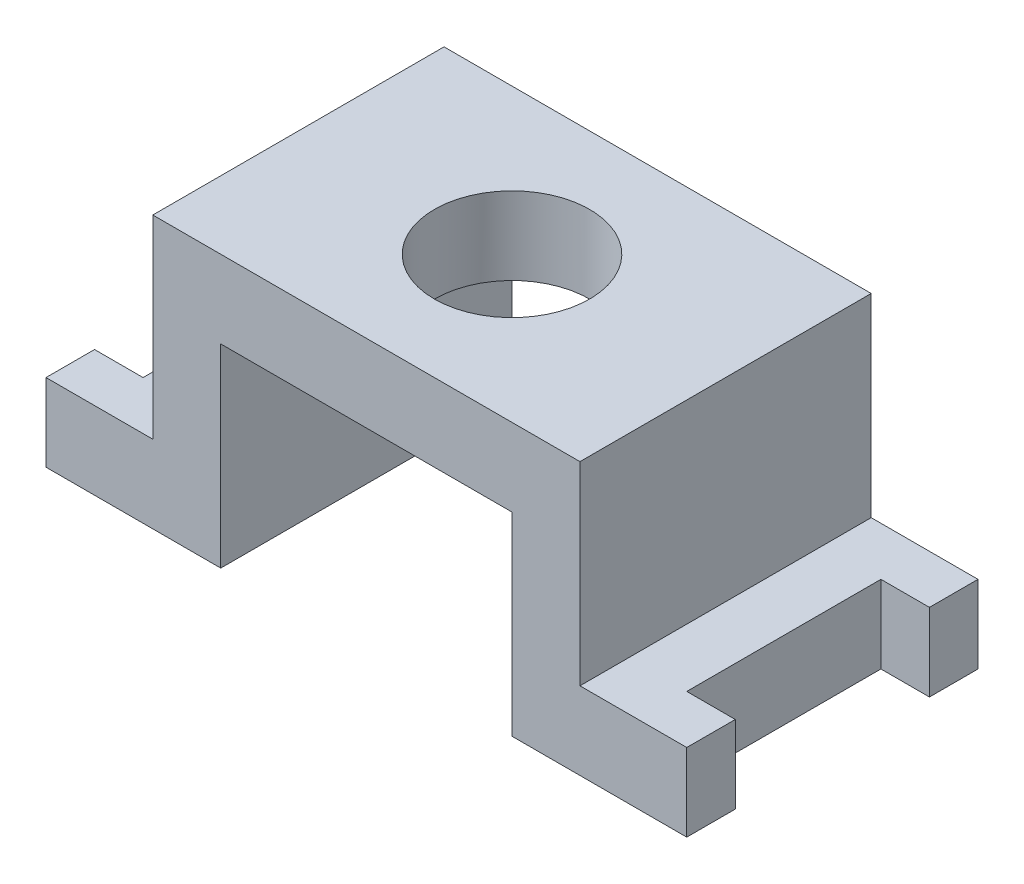
from build123d import *

# Parameters (mm, degrees)
EXTRUDE_1_DEPTH     = 30
SKETCH_3_W          = 5
SKETCH_3_H          = 20
CUT_EXTRUDE_1_DEPTH = 76.206382708
SKETCH_4_R          = 8
CUT_EXTRUDE_2_DEPTH = 78.717436911


with BuildPart() as part:
    # Эскиз1 → Бобышка-Вытянуть1 (new body)
    with BuildSketch(Plane.XY):
        Polygon((0, 0), (0, 8), (11, 8), (11, 28), (55, 28), (55, 8), (66, 8), (66, 0), (48, 0), (48, 20), (18, 20), (18, 0), align=None)
    extrude(amount=EXTRUDE_1_DEPTH)

    # Эскиз3 → Вырез-Вытянуть1 (cut, through all)
    with BuildSketch(Plane(origin=(0, 8, 0), x_dir=(1, 0, 0), z_dir=(0, 1, 0))):
        with Locations((2.5, -15)):
            Rectangle(SKETCH_3_W, SKETCH_3_H)
        with Locations((63.5, -15)):
            Rectangle(SKETCH_3_W, SKETCH_3_H)
    extrude(amount=-CUT_EXTRUDE_1_DEPTH, mode=Mode.SUBTRACT)

    # Эскиз4 → Вырез-Вытянуть2 (cut, through all)
    with BuildSketch(Plane(origin=(0, 28, 0), x_dir=(1, 0, 0), z_dir=(0, 1, 0))):
        with Locations(Location((33, -15, 0), (0, 0, 270))):
            Circle(SKETCH_4_R)
    extrude(amount=-CUT_EXTRUDE_2_DEPTH, mode=Mode.SUBTRACT)


solid = part.part
